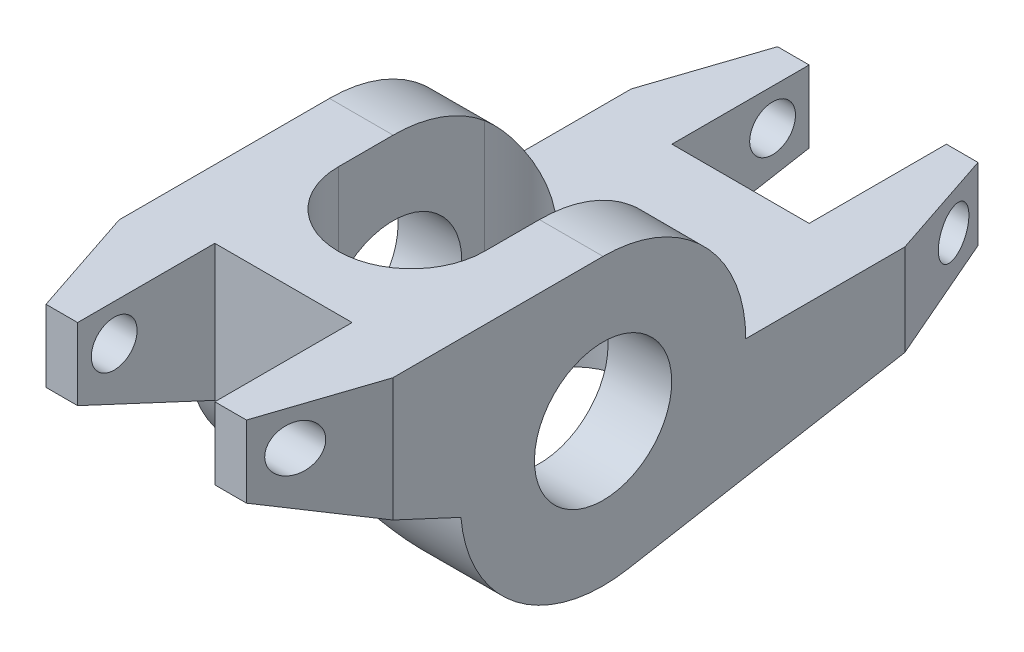
from build123d import *
from OCP.BRepFilletAPI import BRepFilletAPI_MakeChamfer

# Parameters (mm, degrees)
SKETCH1_R               = 4.765
BOSS_EXTRUDE1_DEPTH     = 9.5
CHAMFER1_SIZE           = 2.54
CHAMFER1_SIZE2          = 7.62
CHAMFER3_SIZE           = 7.62
CHAMFER3_SIZE2          = 2.54
CUT_EXTRUDE2_DEPTH      = 32.701013029
CUT_EXTRUDE2_DEPTH_BACK = 32.701013029
SKETCH3_W               = 9.53
SKETCH3_H               = 9.53
CUT_EXTRUDE5_DEPTH      = 50
SKETCH4_R               = 1.59
CUT_EXTRUDE6_DEPTH      = 50


with BuildPart() as part:
    # Sketch1 → Boss-Extrude1 (new, symmetric)
    with BuildSketch(Plane(origin=(0, 0, 0), x_dir=(0, 0, -1), z_dir=(1, 0, 0))):
        with BuildLine():
            Line((0, 9.908259288), (-22.225, 9.908259288))
            Line((-22.225, 9.908259288), (-22.225, 4.908259288))
            Line((-22.225, 4.908259288), (-9.871538087, -0.852254607))
            ThreePointArc((-9.871538087, -0.852254607), (-6.033040367, -7.859772645), (1.728564082, -9.75631428))
            Line((1.728564082, -9.75631428), (28.574999999, -4.999826991))
            Line((28.574999999, -4.999826991), (28.574999999, 0.000173009))
            Line((28.574999999, 0.000173009), (9.908259287, 5.999e-05))
            ThreePointArc((9.908259287, 5.999e-05), (7.006176122, 7.006218542), (0, 9.908259288))
        make_face()
        Circle(SKETCH1_R, mode=Mode.SUBTRACT)
    extrude(amount=BOSS_EXTRUDE1_DEPTH, both=True)

    # Chamfer1: one chamfer whose edges measure the first distance from different faces: ONE call of the kernel's chamfer builder (chamfer() names one face for all edges)
    chamfer1_edges_1 = [part.edges().sort_by_distance(p)[0] for p in [
        (9.5, 7.408259288, 22.225),
    ]]
    chamfer1_side_1 = [part.faces().sort_by_distance(p)[0] for p in [
        (0, 7.408259288, 22.225),
    ]]
    chamfer1_edges_2 = [part.edges().sort_by_distance(p)[0] for p in [
        (9.5, -2.499826991, -28.574999999),
    ]]
    chamfer1_side_2 = [part.faces().sort_by_distance(p)[0] for p in [
        (0, -2.499826991, -28.574999999),
    ]]
    chamfer1 = BRepFilletAPI_MakeChamfer(part.part.solid().wrapped)
    for e in chamfer1_edges_1:
        chamfer1.Add(CHAMFER1_SIZE, CHAMFER1_SIZE2, e.wrapped, chamfer1_side_1[0].wrapped)  # the first distance lies on this face
    for e in chamfer1_edges_2:
        chamfer1.Add(CHAMFER1_SIZE, CHAMFER1_SIZE2, e.wrapped, chamfer1_side_2[0].wrapped)  # the first distance lies on this face
    add(Compound.cast(chamfer1.Shape()), mode=Mode.REPLACE)

    # Chamfer3
    chamfer3_edges = [part.edges().sort_by_distance(p)[0] for p in [
        (-9.5, 7.408259288, 22.225),
        (-9.5, -2.499826991, -28.574999999),
    ]]
    chamfer3_side = [part.faces().sort_by_distance(p)[0] for p in [
        (-9.5, 9.362976388, 11.1125),
    ]]
    chamfer(chamfer3_edges, length=CHAMFER3_SIZE, length2=CHAMFER3_SIZE2, reference=chamfer3_side[0])

    # Sketch2 → Cut-Extrude2 (cut, two sides: drawn at the far end of the back side and taken through both)
    with BuildSketch(Plane(origin=(0, 0, 0), x_dir=(1, 0, 0), z_dir=(0, 1, 0)).offset(-CUT_EXTRUDE2_DEPTH_BACK)):
        with BuildLine():
            Line((-5.08, -3.81), (-5.08, 6.35))
            ThreePointArc((-5.08, 6.35), (0, 11.43), (5.08, 6.35))
            Line((5.08, 6.35), (5.08, -3.81))
            ThreePointArc((5.08, -3.81), (0, -8.89), (-5.08, -3.81))
        make_face()
    extrude(amount=CUT_EXTRUDE2_DEPTH + CUT_EXTRUDE2_DEPTH_BACK, mode=Mode.SUBTRACT)

    # Sketch3 → Cut-Extrude5 (cut, symmetric)
    with BuildSketch(Plane(origin=(0, 0, 0), x_dir=(1, 0, 0), z_dir=(0, 0.9999999999816713, 6.054544672321462e-06))):
        Polygon((-4.765, -22.22494001), (-4.765, -26.288329998), (4.765, -26.288329998), (4.765, -22.22494001), (4.765, -12.69494001), (-4.765, -12.69494001), align=None)
        with Locations((0, 23.81)):
            Rectangle(SKETCH3_W, SKETCH3_H)
    extrude(amount=CUT_EXTRUDE5_DEPTH, both=True, mode=Mode.SUBTRACT)

    # Sketch4 → Cut-Extrude6 (cut, symmetric)
    with BuildSketch(Plane(origin=(0, 0, 0), x_dir=(0, 0, -1), z_dir=(1, 0, 0))):
        with Locations((26.034999999, -2.53984237)):
            Circle(SKETCH4_R)
        with Locations(Location((-19.685, 7.368259288, 0), (0, 0, 180))):
            Circle(SKETCH4_R)
    extrude(amount=CUT_EXTRUDE6_DEPTH, both=True, mode=Mode.SUBTRACT)


solid = part.part
